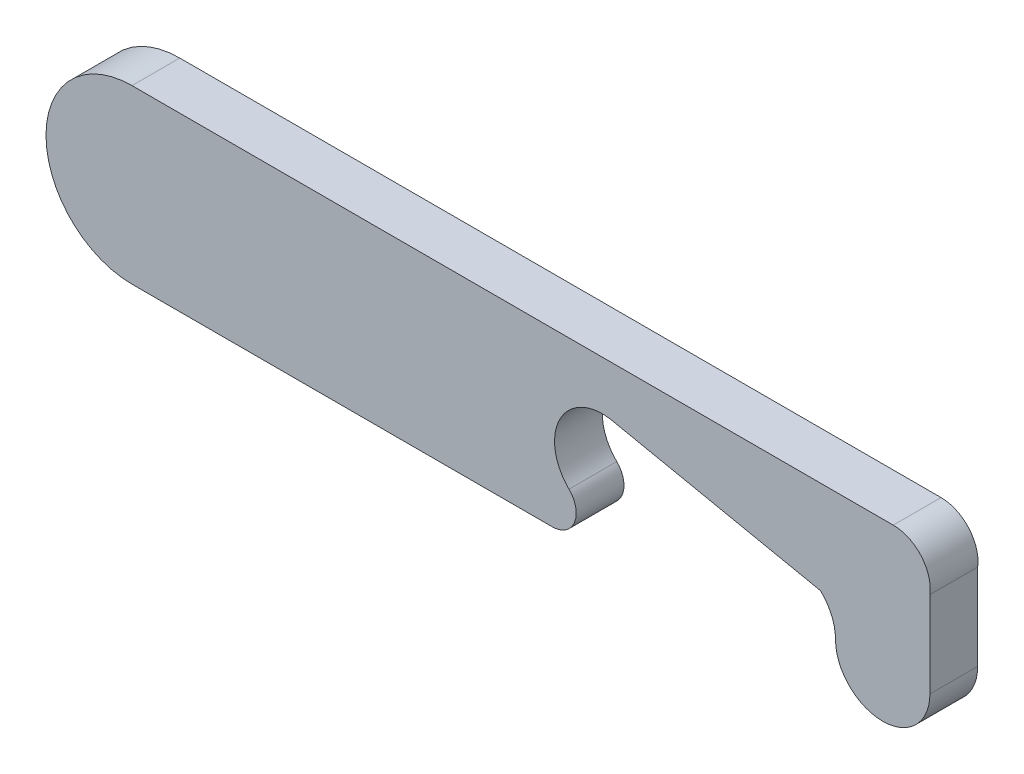
from build123d import *

# Parameters (mm, degrees)
BOSS_EXTRUDE2_DEPTH = 5000
BOSS_EXTRUDE6_DEPTH = 1212


with BuildPart() as part:
    # Sketch1 → Boss-Extrude2 (new body)
    with BuildSketch(Plane.XY):
        with BuildLine():
            Line((5907.51269427, 7762.337878808), (85590.03917175, 7762.337878808))
            ThreePointArc((85590.03917175, 7762.337878808), (88505.13507032, 6438.615293192), (89426.888836533, 3372.608839186))
            Line((89426.888836533, 3372.608839186), (89426.888836533, -5627.391160814))
            ThreePointArc((89426.888836533, -5627.391160814), (84486.967683967, -10567.31231338), (79547.046531401, -5627.391160814))
            ThreePointArc((79547.046531401, -5627.391160814), (79137.473389404, -3645.477625535), (77975.854026873, -1988.259511781))
            Line((77975.854026873, -1988.259511781), (55942.725833298, 2571.484121965))
            ThreePointArc((55942.725833298, 2571.484121965), (50673.68769565, -113.801167554), (51651.337002069, -5946.272497595))
            ThreePointArc((51651.337002069, -5946.272497595), (52223.594953063, -8678.811934189), (49907.51269427, -10237.662121192))
            Line((49907.51269427, -10237.662121192), (5907.51269427, -10237.662121192))
            ThreePointArc((5907.51269427, -10237.662121192), (-3092.48730573, -1237.662121192), (5907.51269427, 7762.337878808))
        make_face()
    extrude(amount=BOSS_EXTRUDE2_DEPTH)

    # Sketch3 → Boss-Extrude6 (add)
    with BuildSketch(Plane.XY.offset(5000)):
        with BuildLine():
            Line((85590.03917175, 6562.337878808), (5907.51269427, 6562.337878808))
            ThreePointArc((5907.51269427, 6562.337878808), (-1892.48730573, -1237.662121192), (5907.51269427, -9037.662121192))
            Line((5907.51269427, -9037.662121192), (49907.51269427, -9037.662121192))
            ThreePointArc((49907.51269427, -9037.662121192), (51111.875468842, -8227.06002395), (50814.301334326, -6806.139516922))
            ThreePointArc((50814.301334326, -6806.139516922), (49608.09207013, 438.152081508), (56162.21300372, 3751.488819598))
            Line((56162.21300372, 3751.488819598), (78532.454339426, -878.020191545))
            ThreePointArc((78532.454339426, -878.020191545), (80166.18918886, -3007.231662783), (80747.046531401, -5627.391160814))
            ThreePointArc((80747.046531401, -5627.391160814), (84486.967683967, -9367.31231338), (88226.888836533, -5627.391160814))
            Line((88226.888836533, -5627.391160814), (88226.888836533, 3460.755560892))
            ThreePointArc((88226.888836533, 3460.755560892), (87625.523698188, 5621.164140917), (85590.03917175, 6562.337878808))
        make_face()
    extrude(amount=-BOSS_EXTRUDE6_DEPTH)


solid = part.part
